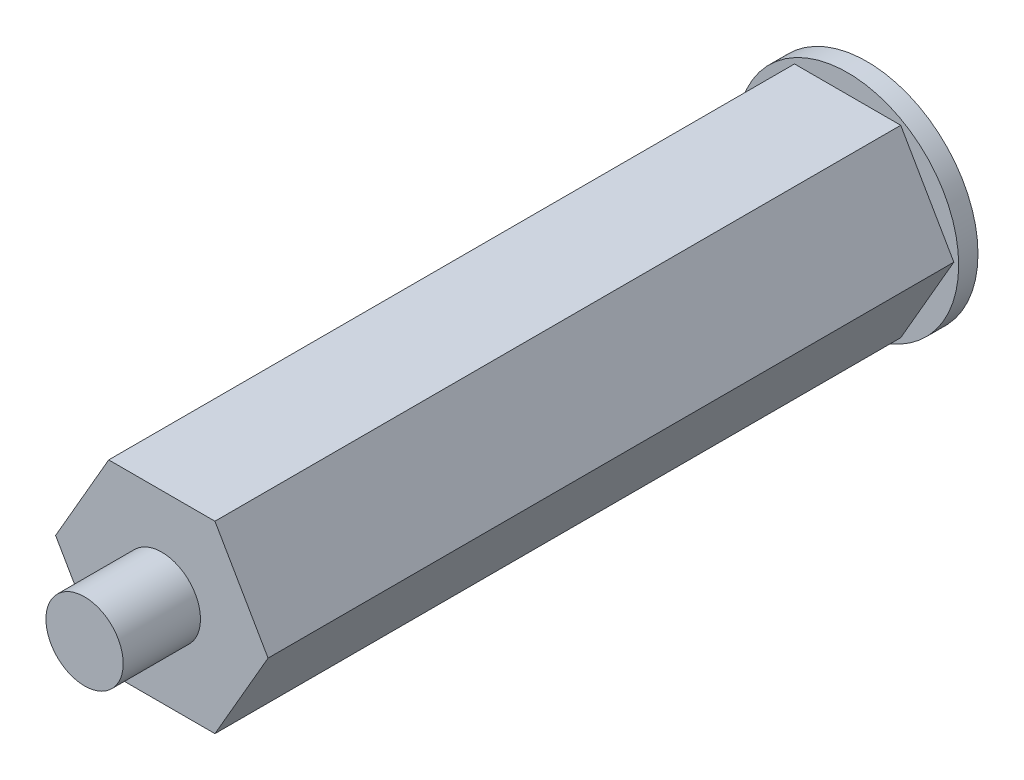
from build123d import *

# Parameters (mm, degrees)
BOSS_EXTRUDE1_DEPTH      = 35.5
BOSS_EXTRUDE1_DEPTH_BACK = 35.5
CUT_EXTRUDE1_DEPTH       = 6
SKETCH4_R                = 11.5
SKETCH4_R_2              = 8.5
BOSS_EXTRUDE3_DEPTH      = 2
SKETCH5_R                = 4
BOSS_EXTRUDE4_DEPTH      = 8


with BuildPart() as part:
    # Sketch1 → Boss-Extrude1 (new, two sides: drawn at the far end of the back side and taken through both)
    with BuildSketch(Plane.XY.offset(-BOSS_EXTRUDE1_DEPTH_BACK)):
        Polygon((10.998522628, 0), (5.499261314, 9.525), (-5.499261314, 9.525), (-10.998522628, 0), (-5.499261314, -9.525), (5.499261314, -9.525), align=None)
    extrude(amount=BOSS_EXTRUDE1_DEPTH + BOSS_EXTRUDE1_DEPTH_BACK)

    # Sketch2 → Cut-Extrude1 (cut)
    with BuildSketch(Plane(origin=(0, 0, -35.5), x_dir=(-1, 0, 0), z_dir=(0, 0, -1))):
        Polygon((7.101408311, 0), (3.550704156, 6.15), (-3.550704156, 6.15), (-7.101408311, 0), (-3.550704156, -6.15), (3.550704156, -6.15), align=None)
    extrude(amount=-CUT_EXTRUDE1_DEPTH, mode=Mode.SUBTRACT)

    # Sketch4 → Boss-Extrude3 (add)
    with BuildSketch(Plane(origin=(0, 0, -35.5), x_dir=(-1, 0, 0), z_dir=(0, 0, -1))):
        Circle(SKETCH4_R)
        Circle(SKETCH4_R_2, mode=Mode.SUBTRACT)
    extrude(amount=BOSS_EXTRUDE3_DEPTH)

    # Sketch5 → Boss-Extrude4 (add)
    with BuildSketch(Plane.XY.offset(35.5)):
        Circle(SKETCH5_R)
    extrude(amount=BOSS_EXTRUDE4_DEPTH)


solid = part.part
